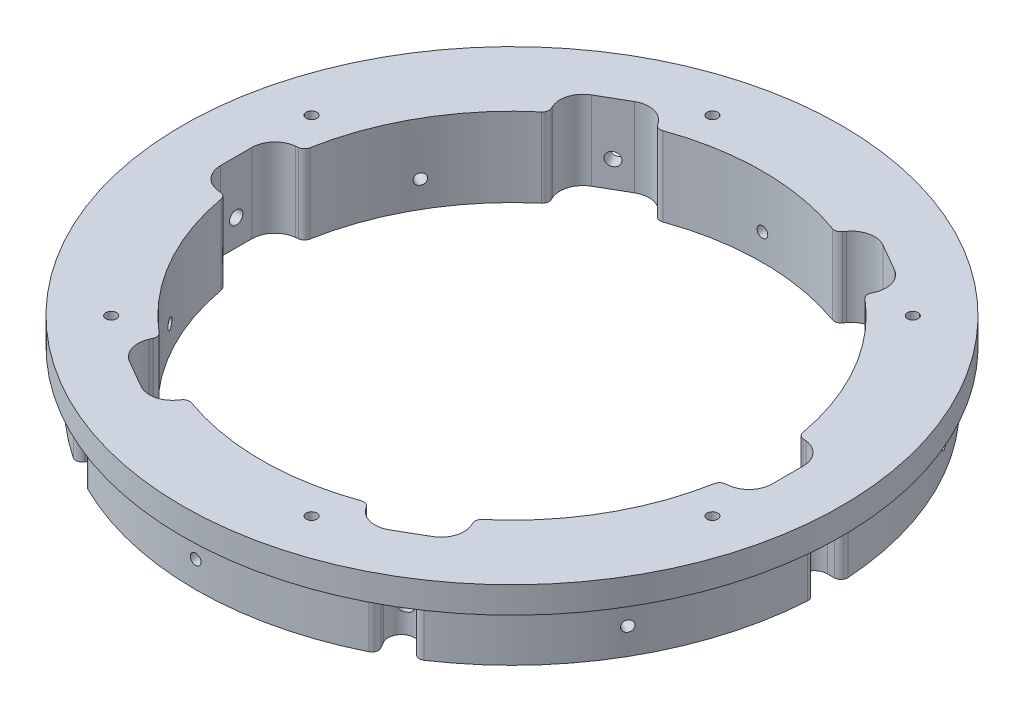
from build123d import *

# Parameters (mm, degrees)
SKETCH1_R                        = 76.2
SKETCH1_R_2                      = 60.325
BOSS_EXTRUDE1_DEPTH              = 19.05
CUT_EXTRUDE1_START               = -12.7
CUT_EXTRUDE1_DEPTH               = 12.7
CUT_EXTRUDE2_DEPTH               = 110.433918417
F_1_8_0_125_DIAMETER_HOLE1_D     = 3.175
F_1_8_0_125_DIAMETER_HOLE1_DEPTH = 9.779
FILLET1_R                        = 1.5875
FILLET2_R                        = 5.55625
SKETCH9_R                        = 1.28905
CUT_EXTRUDE3_DEPTH               = 110.433918434
SKETCH11_R                       = 1.28905
CUT_EXTRUDE5_DEPTH               = 110.433918573
CIRPATTERN1_COUNT                = 6
FILLET1_OF_CIRPATTERN1_R         = 1.5875
FILLET2_OF_CIRPATTERN1_R         = 5.55625
SKETCH8_R                        = 79.375
SKETCH8_R_2                      = 76.2
BOSS_EXTRUDE3_DEPTH              = 6.35


with BuildPart() as part:
    # Sketch1 → Boss-Extrude1 (new body)
    with BuildSketch(Plane(origin=(0, 0, 0), x_dir=(1, 0, 0), z_dir=(0, 1, 0))):
        with Locations(Location((0, 0, 0), (0, 0, 270))):
            Circle(SKETCH1_R)
        with Locations(Location((0, 0, 0), (0, 0, 270))):
            Circle(SKETCH1_R_2, mode=Mode.SUBTRACT)
    extrude(amount=-BOSS_EXTRUDE1_DEPTH)

    # Sketch3 → Cut-Extrude1 (cut)
    with BuildSketch(Plane(origin=(0, -19.05, 0), x_dir=(-1, 0, 0), z_dir=(0, -1, 0)).offset(CUT_EXTRUDE1_START)):
        with BuildLine():
            Line((-76.133825433, 3.175), (-72.771, 3.175))
            ThreePointArc((-72.771, 3.175), (-69.596, 0), (-72.771, -3.175))
            Line((-72.771, -3.175), (-76.133825433, -3.175))
            ThreePointArc((-76.133825433, -3.175), (-76.2, 0), (-76.133825433, 3.175))
        make_face()
    cut_extrude1 = extrude(amount=CUT_EXTRUDE1_DEPTH, mode=Mode.SUBTRACT)

    # Sketch4 → Cut-Extrude2 (cut, through all)
    with BuildSketch(Plane(origin=(0, -19.05, 0), x_dir=(-1, 0, 0), z_dir=(0, -1, 0))):
        Polygon((-66.421, 8.73125), (-66.421, -8.73125), (-59.56828015, -9.525), (-59.56828015, 9.525), align=None)
    cut_extrude2 = extrude(amount=-CUT_EXTRUDE2_DEPTH, mode=Mode.SUBTRACT)

    # 1/8 (0.125) Diameter Hole1
    with Locations(Plane.ZY.offset(-66.421)):
        with Locations((0, -12.7)):
            f_1_8_0_125_diameter_hole1 = Hole(F_1_8_0_125_DIAMETER_HOLE1_D / 2, depth=F_1_8_0_125_DIAMETER_HOLE1_DEPTH)

    # Fillet1
    fillet1_edges = [part.edges().sort_by_distance(p)[0] for p in [
        (76.133825433, -12.7, 3.175),
        (76.133825433, -12.7, -3.175),
        (59.56828015, -9.525, -9.525),
        (59.56828015, -9.525, 9.525),
    ]]
    fillet(fillet1_edges, radius=FILLET1_R)

    # Fillet2
    fillet2_edges = [part.edges().sort_by_distance(p)[0] for p in [
        (66.421, -9.525, -8.73125),
        (66.421, -9.525, 8.73125),
    ]]
    fillet(fillet2_edges, radius=FILLET2_R)

    # Sketch9 → Cut-Extrude3 (cut, through all)
    with BuildSketch(Plane.XY):
        with Locations((0, -12.7)):
            Circle(SKETCH9_R)
    cut_extrude3 = extrude(amount=-CUT_EXTRUDE3_DEPTH, mode=Mode.SUBTRACT)

    # Sketch11 → Cut-Extrude5 (cut, through all)
    with BuildSketch(Plane.XZ.offset(19.05)):
        with Locations(Location((65.936511717, 17.667635066, 0), (0, 0, 270))):
            Circle(SKETCH11_R)
    cut_extrude5 = extrude(amount=-CUT_EXTRUDE5_DEPTH, mode=Mode.SUBTRACT)

    # CirPattern1: Cut-Extrude1, Cut-Extrude2, 1/8 (0.125) Diameter Hole1, Cut-Extrude3, Cut-Extrude5 ×6 about axis
    cirpattern1_axis = Axis((0, 0, 0), (0, 1, 0))
    add([cut_extrude1.rotate(cirpattern1_axis, i * 360 / CIRPATTERN1_COUNT) for i in range(1, CIRPATTERN1_COUNT)], mode=Mode.SUBTRACT)
    add([cut_extrude2.rotate(cirpattern1_axis, i * 360 / CIRPATTERN1_COUNT) for i in range(1, CIRPATTERN1_COUNT)], mode=Mode.SUBTRACT)
    add([f_1_8_0_125_diameter_hole1.rotate(cirpattern1_axis, i * 360 / CIRPATTERN1_COUNT) for i in range(1, CIRPATTERN1_COUNT)], mode=Mode.SUBTRACT)
    add([cut_extrude3.rotate(cirpattern1_axis, i * 360 / CIRPATTERN1_COUNT) for i in range(1, CIRPATTERN1_COUNT)], mode=Mode.SUBTRACT)
    add([cut_extrude5.rotate(cirpattern1_axis, i * 360 / CIRPATTERN1_COUNT) for i in range(1, CIRPATTERN1_COUNT)], mode=Mode.SUBTRACT)

    # Fillet1 of CirPattern1
    fillet1_of_cirpattern1_edges = [part.edges().sort_by_distance(p)[0] for p in [
        (40.816543373, -12.7, -64.346326912),
        (35.317282059, -12.7, -67.521326912),
        (21.535248104, -9.525, -56.350143869),
        (38.033032046, -9.525, -46.825143869),
        (-35.317282059, -12.7, -67.521326912),
        (-40.816543373, -12.7, -64.346326912),
        (-38.033032046, -9.525, -46.825143869),
        (-21.535248104, -9.525, -56.350143869),
        (-76.133825433, -12.7, -3.175),
        (-76.133825433, -12.7, 3.175),
        (-59.56828015, -9.525, 9.525),
        (-59.56828015, -9.525, -9.525),
        (-40.816543373, -12.7, 64.346326912),
        (-35.317282059, -12.7, 67.521326912),
        (-21.535248104, -9.525, 56.350143869),
        (-38.033032046, -9.525, 46.825143869),
        (35.317282059, -12.7, 67.521326912),
        (40.816543373, -12.7, 64.346326912),
        (38.033032046, -9.525, 46.825143869),
        (21.535248104, -9.525, 56.350143869),
    ]]
    fillet(fillet1_of_cirpattern1_edges, radius=FILLET1_OF_CIRPATTERN1_R)

    # Fillet2 of CirPattern1
    fillet2_of_cirpattern1_edges = [part.edges().sort_by_distance(p)[0] for p in [
        (25.649015693, -9.525, -61.887898345),
        (40.771984307, -9.525, -53.156648345),
        (-40.771984307, -9.525, -53.156648345),
        (-25.649015693, -9.525, -61.887898345),
        (-66.421, -9.525, 8.73125),
        (-66.421, -9.525, -8.73125),
        (-25.649015693, -9.525, 61.887898345),
        (-40.771984307, -9.525, 53.156648345),
        (40.771984307, -9.525, 53.156648345),
        (25.649015693, -9.525, 61.887898345),
    ]]
    fillet(fillet2_of_cirpattern1_edges, radius=FILLET2_OF_CIRPATTERN1_R)

    # Sketch8 → Boss-Extrude3 (add)
    with BuildSketch(Plane(origin=(0, 0, 0), x_dir=(1, 0, 0), z_dir=(0, 1, 0))):
        with Locations(Location((0, 0, 0), (0, 0, 270))):
            Circle(SKETCH8_R)
        Circle(SKETCH8_R_2, mode=Mode.SUBTRACT)
    extrude(amount=-BOSS_EXTRUDE3_DEPTH)


solid = part.part
